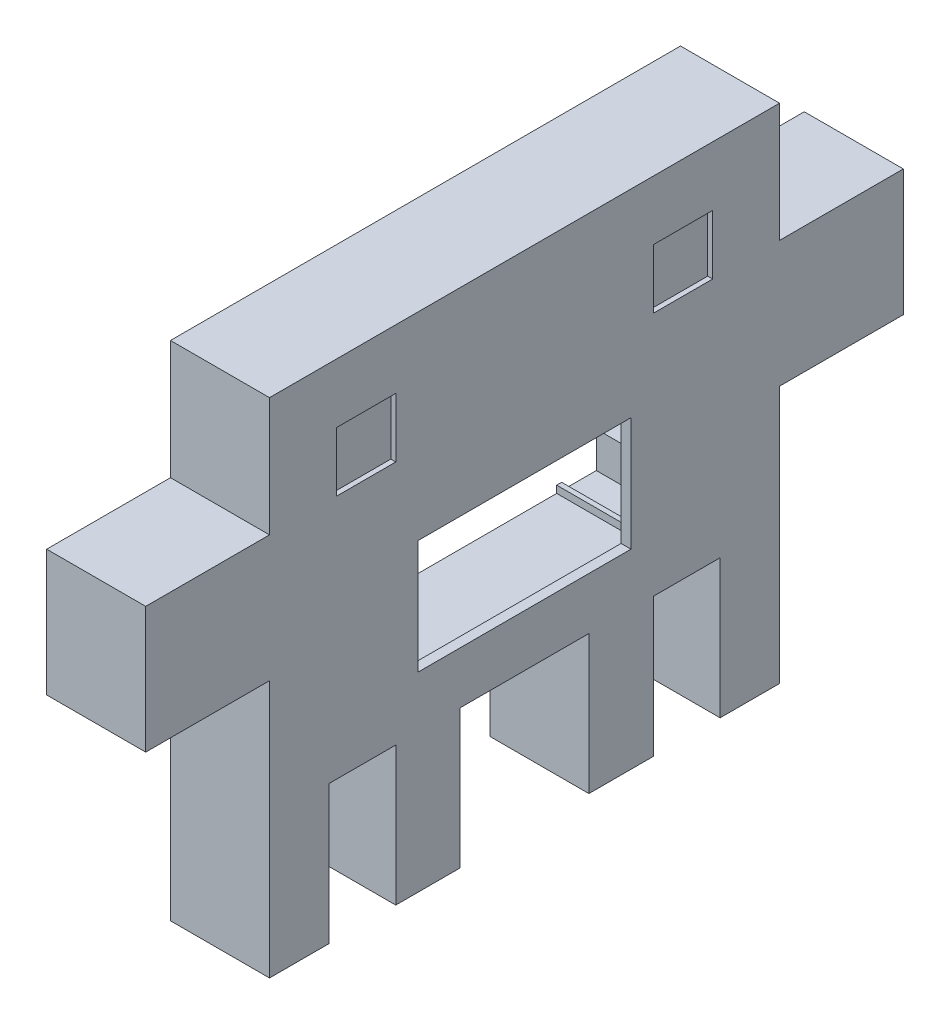
from build123d import *

# Parameters (mm, degrees)
SKETCH_2_W          = 12
SKETCH_2_H          = 12
SKETCH_2_W_2        = 43
SKETCH_2_H_2        = 23
EXTRUDE_1_DEPTH     = 20
SKETCH_3_W          = 86.114957356
SKETCH_3_H          = 19.725477411
EXTRUDE_2_DEPTH     = 19
CUT_EXTRUDE_1_DEPTH = 18
CUT_EXTRUDE_2_DEPTH = 17


with BuildPart() as part:
    # 草图2 → 凸台-拉伸1 (new body)
    with BuildSketch(Plane(origin=(0, 0, 0), x_dir=(0, 0, -1), z_dir=(1, 0, 0))):
        Polygon((109.86010867, 259.687677289), (122.86010867, 259.687677289), (122.86010867, 287.687677289), (148.86010867, 287.687677289), (148.86010867, 259.687677289), (161.86010867, 259.687677289), (161.86010867, 287.687677289), (175.36010867, 287.687677289), (175.36010867, 259.687677289), (187.36010867, 259.687677289), (187.36010867, 311.687677289), (212.36010867, 311.687677289), (212.36010867, 337.187677289), (187.36010867, 337.187677289), (187.36010867, 361.187677289), (84.36010867, 361.187677289), (84.36010867, 337.187677289), (59.36010867, 337.187677289), (59.36010867, 311.687677289), (84.36010867, 311.687677289), (84.36010867, 259.687677289), (96.36010867, 259.687677289), (96.36010867, 287.687677289), (109.86010867, 287.687677289), align=None)
        with Locations((103.86010867, 343.187677289)):
            Rectangle(SKETCH_2_W, SKETCH_2_H, mode=Mode.SUBTRACT)
        with Locations((135.86010867, 309.687677289)):
            Rectangle(SKETCH_2_W_2, SKETCH_2_H_2, mode=Mode.SUBTRACT)
        with Locations((167.86010867, 343.187677289)):
            Rectangle(SKETCH_2_W, SKETCH_2_H, mode=Mode.SUBTRACT)
    extrude(amount=EXTRUDE_1_DEPTH)

    # 草图3 → 凸台-拉伸2 (add)
    with BuildSketch(Plane.ZY):
        with Locations((-135.786506142, 344.147634955)):
            Rectangle(SKETCH_3_W, SKETCH_3_H)
    extrude(amount=-EXTRUDE_2_DEPTH)

    # 草图4 → 切除-拉伸1 (cut)
    with BuildSketch(Plane.ZY):
        Polygon((-170.36010867, 323.937677289), (-163.36010867, 323.937677289), (-163.36010867, 322.487677289), (-162.36010867, 322.487677289), (-162.36010867, 323.937677289), (-111.36010867, 323.937677289), (-111.36010867, 322.487677289), (-110.36010867, 322.487677289), (-110.36010867, 323.937677289), (-103.36010867, 323.937677289), (-103.36010867, 295.437677289), (-110.36010867, 295.437677289), (-110.36010867, 296.887677289), (-111.36010867, 296.887677289), (-111.36010867, 295.437677289), (-162.36010867, 295.437677289), (-162.36010867, 296.887677289), (-163.36010867, 296.887677289), (-163.36010867, 295.437677289), (-170.36010867, 295.437677289), align=None)
    extrude(amount=-CUT_EXTRUDE_1_DEPTH, mode=Mode.SUBTRACT)

    # 草图5 → 切除-拉伸2 (cut)
    with BuildSketch(Plane.ZY):
        Polygon((-192.36010867, 316.687677289), (-157.36010867, 316.687677289), (-157.36010867, 302.687677289), (-177.960754488, 302.687677289), (-177.960754488, 259.687677289), (-184.732187032, 259.687677289), (-184.732187032, 302.687677289), (-192.36010867, 302.687677289), align=None)
    extrude(amount=-CUT_EXTRUDE_2_DEPTH, mode=Mode.SUBTRACT)


solid = part.part
